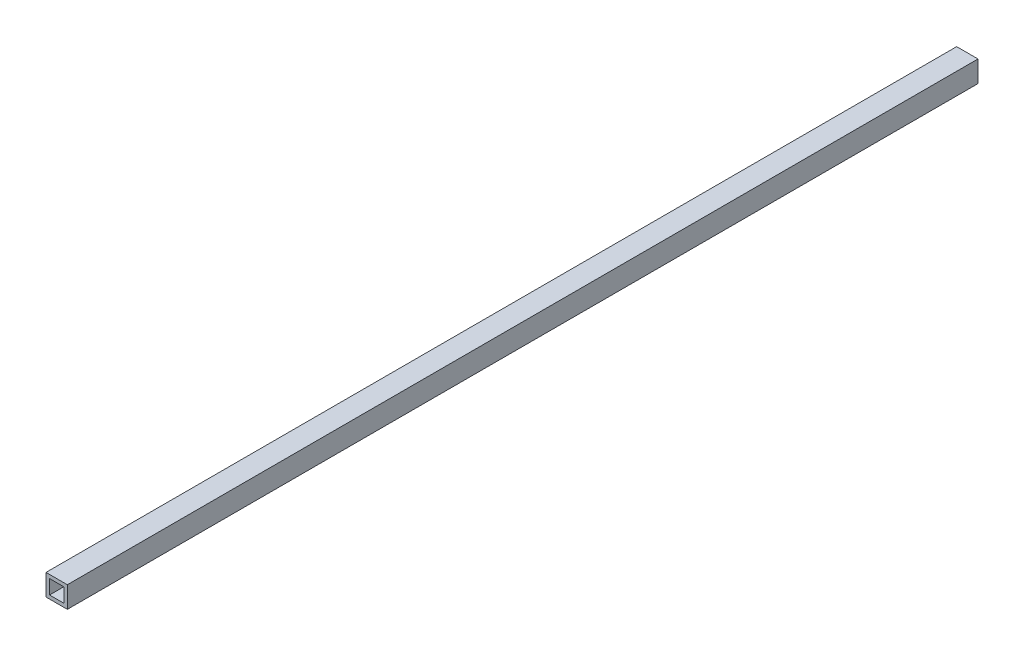
from build123d import *

# Parameters (mm, degrees)
SKETCH1_W           = 19.05
SKETCH1_H           = 19.05
BOSS_EXTRUDE1_DEPTH = 812.8
SKETCH2_W           = 12.7
SKETCH2_H           = 12.7
CUT_EXTRUDE1_DEPTH  = 812.8


with BuildPart() as part:
    # Sketch1 → Boss-Extrude1 (new body)
    with BuildSketch(Plane.XY):
        with Locations((401.693972332, 193.675)):
            Rectangle(SKETCH1_W, SKETCH1_H)
    extrude(amount=BOSS_EXTRUDE1_DEPTH)

    # Sketch2 → Cut-Extrude1 (cut)
    with BuildSketch(Plane(origin=(0, 0, 0), x_dir=(-1, 0, 0), z_dir=(0, 0, -1))):
        with Locations((-401.693972332, 193.675)):
            Rectangle(SKETCH2_W, SKETCH2_H)
    extrude(amount=-CUT_EXTRUDE1_DEPTH, mode=Mode.SUBTRACT)


solid = part.part
